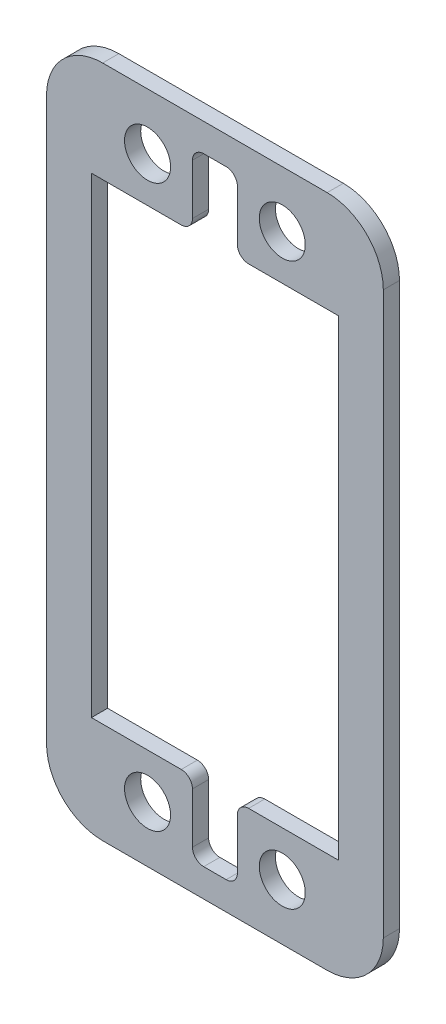
from build123d import *

# Parameters (mm, degrees)
CROQUIS1_W              = 30
CROQUIS1_H              = 60
SALIENTE_EXTRUIR1_DEPTH = 1.44
CROQUIS2_W              = 22
CROQUIS2_H              = 42
CORTAR_EXTRUIR1_DEPTH   = 34.571916835
CROQUIS3_R              = 2.05
CORTAR_EXTRUIR2_DEPTH   = 34.571916835
REDONDEO1_R             = 5
REDONDEO3_R             = 1


with BuildPart() as part:
    # Croquis1 → Saliente-Extruir1 (new body)
    with BuildSketch(Plane.XY):
        Rectangle(CROQUIS1_W, CROQUIS1_H)
    extrude(amount=SALIENTE_EXTRUIR1_DEPTH)

    # Croquis2 → Cortar-Extruir1 (cut, through all)
    with BuildSketch(Plane(origin=(0, 0, 0), x_dir=(-1, 0, 0), z_dir=(0, 0, -1))):
        Rectangle(CROQUIS2_W, CROQUIS2_H)
    extrude(amount=-CORTAR_EXTRUIR1_DEPTH, mode=Mode.SUBTRACT)

    # Croquis3 → Cortar-Extruir2 (cut, through all)
    with BuildSketch(Plane(origin=(0, 0, 0), x_dir=(-1, 0, 0), z_dir=(0, 0, -1))):
        with Locations((-6, 25)):
            Circle(CROQUIS3_R)
        with Locations((6, 25)):
            Circle(CROQUIS3_R)
        with Locations((-6, -25)):
            Circle(CROQUIS3_R)
        with Locations((6, -25)):
            Circle(CROQUIS3_R)
        Polygon((-2, 21), (-2, 27.5), (2, 27.5), (2, -27.5), (-2, -27.5), align=None)
    extrude(amount=-CORTAR_EXTRUIR2_DEPTH, mode=Mode.SUBTRACT)

    # Redondeo1
    redondeo1_edges = [part.edges().sort_by_distance(p)[0] for p in [
        (-15, 30, 0.72),
        (15, 30, 0.72),
        (15, -30, 0.72),
        (-15, -30, 0.72),
    ]]
    fillet(redondeo1_edges, radius=REDONDEO1_R)

    # Redondeo3
    redondeo3_edges = [part.edges().sort_by_distance(p)[0] for p in [
        (2, -21, 0.72),
        (-2, -21, 0.72),
        (-2, 21, 0.72),
        (-2, 27.5, 0.72),
        (2, 21, 0.72),
        (2, -27.5, 0.72),
        (-2, -27.5, 0.72),
        (2, 27.5, 0.72),
    ]]
    fillet(redondeo3_edges, radius=REDONDEO3_R)


solid = part.part
